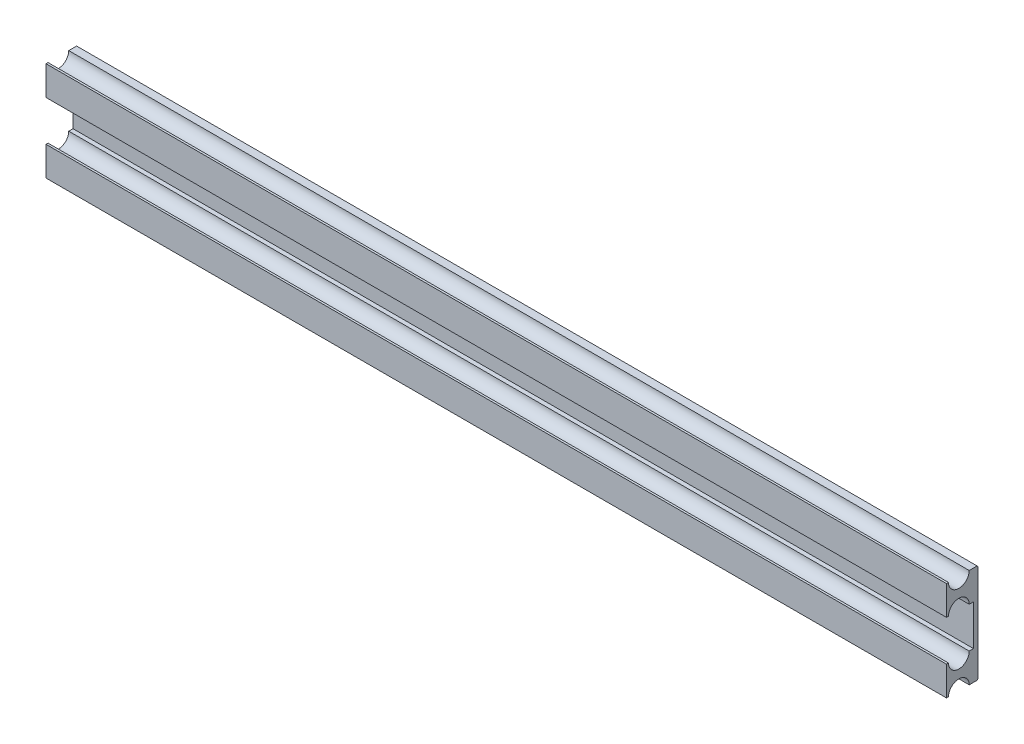
from build123d import *

# Parameters (mm, degrees)
SKETCH1_W              = 200
SKETCH1_H              = 22
BOSS_EXTRUDE1_DEPTH    = 1
SKETCH2_W              = 200
SKETCH2_H              = 6.5
BOSS_EXTRUDE2_DEPTH    = 6
SKETCH5_R              = 2.3
SLOT_1_DEPTH           = 101.781942827
SLOT_2_COPY_1_SKETCH_R = 2.3
SLOT_2_COPY_1_DEPTH    = 101.781942827
DEBURS_SIZE            = 0.2


with BuildPart() as part:
    # Sketch1 → Boss-Extrude1 (new body)
    with BuildSketch(Plane.XY):
        Rectangle(SKETCH1_W, SKETCH1_H)
    extrude(amount=-BOSS_EXTRUDE1_DEPTH)

    # Sketch2 → Boss-Extrude2 (add)
    with BuildSketch(Plane.XY):
        with Locations((0, 7.75)):
            Rectangle(SKETCH2_W, SKETCH2_H)
        with Locations((0, -7.75)):
            Rectangle(SKETCH2_W, SKETCH2_H)
    extrude(amount=BOSS_EXTRUDE2_DEPTH)

    # Sketch5 → Slot 1 (cut, symmetric)
    with BuildSketch(Plane(origin=(0, 0, 0), x_dir=(0, 0, -1), z_dir=(1, 0, 0))):
        with Locations((-3.25, 4.5)):
            Circle(SKETCH5_R)
    slot_1 = extrude(amount=SLOT_1_DEPTH, both=True, mode=Mode.SUBTRACT)

    # Slot 1x2: Slot 1 across plane
    add(slot_1.mirror(Plane(origin=(0, 7.75, 0), x_dir=(0, 0, 1), z_dir=(0, -1, 0))), mode=Mode.SUBTRACT)

    # Slot 2: Slot 1 across plane
    add(slot_1.mirror(Plane.ZX), mode=Mode.SUBTRACT)

    # Slot 2 copy 1 sketch → Slot 2 copy 1 (cut, symmetric)
    with BuildSketch(Plane(origin=(0, -15.5, 0), x_dir=(0, 0, -1), z_dir=(1, 0, 0))):
        with Locations((-3.25, 4.5)):
            Circle(SLOT_2_COPY_1_SKETCH_R)
    extrude(amount=SLOT_2_COPY_1_DEPTH, both=True, mode=Mode.SUBTRACT)

    # Deburs
    deburs_edges = [part.edges().sort_by_distance(p)[0] for p in [
        (0, 11, -1),
        (0, -11, -1),
    ]]
    chamfer(deburs_edges, length=DEBURS_SIZE)


solid = part.part
